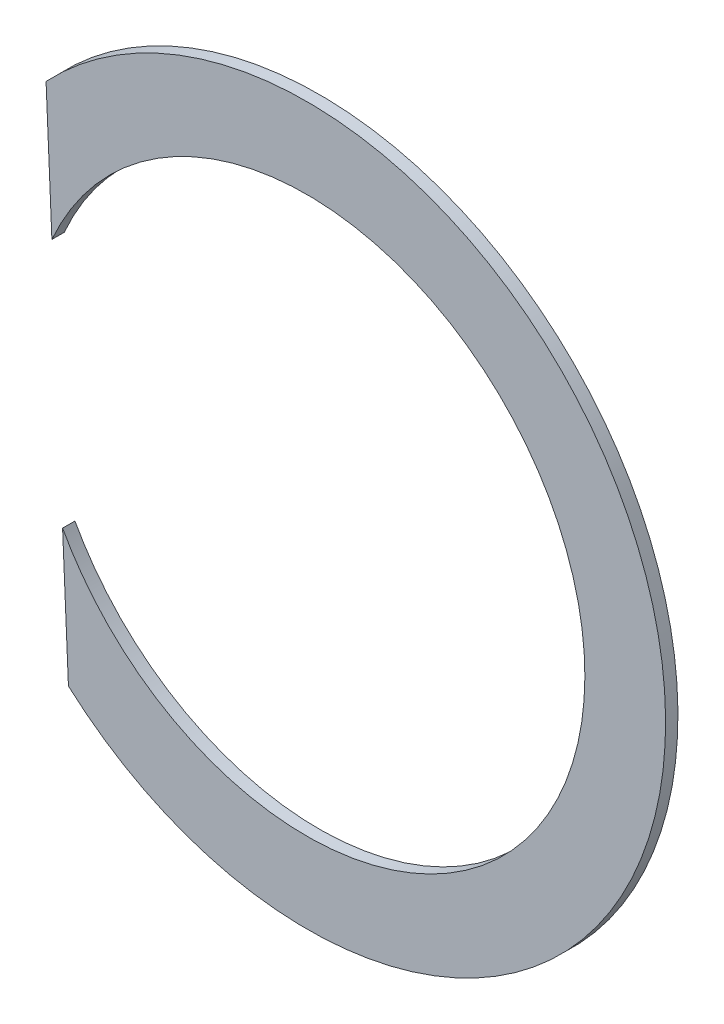
from build123d import *

# Parameters (mm, degrees)
EXTRUDE_1_DEPTH = 1


with BuildPart() as part:
    # 草图3 → 凸台-拉伸1 (new body)
    with BuildSketch(Plane.XY):
        with BuildLine():
            Line((-19.723549586, -10.784013178), (-19.250103383, -21.627714016))
            ThreePointArc((-19.250103383, -21.627714016), (29.072303248, 1.269324172), (-21.061830407, 19.867656976))
            Line((-21.061830407, 19.867656976), (-20.588384204, 9.023956139))
            add(Edge.make_bspline(
                [(-19.723549586, -10.784013178), (-6.256596163, -35.419121771), (14.880438996, -16.923282444), (36.017474154, 1.572556883), (13.348853182, 18.155799958), (-9.319767791, 34.739043034), (-20.588384204, 9.023956139)],
                knots=[3.597855631, 3.597855631, 3.597855631, 5.388075415, 5.388075415, 7.178295199, 7.178295199, 8.968514984, 8.968514984, 8.968514984], degree=2, weights=[1, 0.625433074, 1, 0.625433074, 1, 0.625433074, 1]))
        make_face()
    extrude(amount=EXTRUDE_1_DEPTH)


solid = part.part
